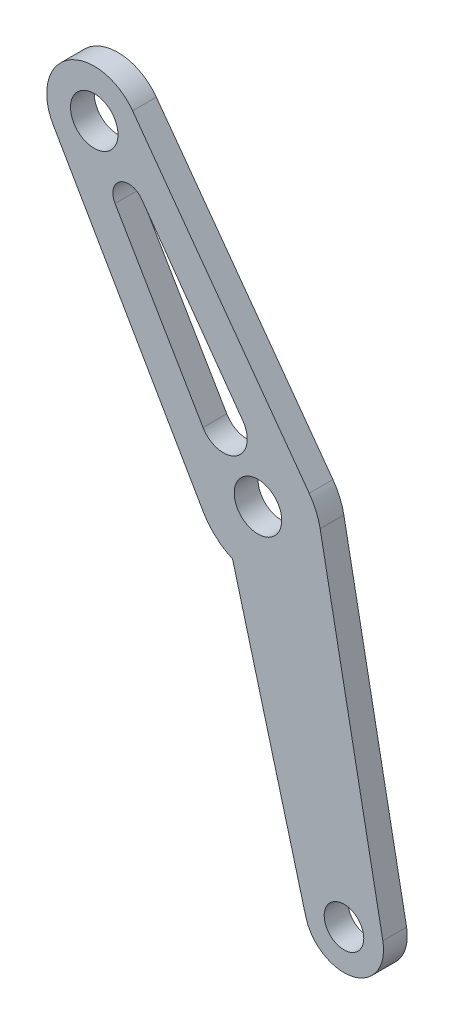
from build123d import *

# Parameters (mm, degrees)
SKETCH_2_R      = 2.5
SKETCH_2_R_2    = 3
EXTRUDE_1_DEPTH = 3


with BuildPart() as part:
    # 草图2 → 凸台-拉伸1 (new body)
    with BuildSketch(Plane.XY):
        with BuildLine():
            Line((-37.947439952, 28.393304212), (-18.983503384, -4.475664586))
            ThreePointArc((-18.983503384, -4.475664586), (-17.391534203, -6.436907823), (-15.267421048, -7.804015799))
            Line((-15.267421048, -7.804015799), (-6.013345572, -42.340695651))
            ThreePointArc((-6.013345572, -42.340695651), (-0.063044856, -45.919391741), (3.726011827, -40.100784195))
            Line((3.726011827, -40.100784195), (-4.198551107, 1.035590248))
            ThreePointArc((-4.198551107, 1.035590248), (-4.715435995, 2.707212985), (-5.583372683, 4.226482041))
            Line((-5.583372683, 4.226482041), (-27.897341927, 34.919914183))
            ThreePointArc((-27.897341927, 34.919914183), (-36.018233875, 36.423789268), (-37.947439952, 28.393304212))
        make_face()
        with Locations((-1.18371644, -41.046600426)):
            Circle(SKETCH_2_R, mode=Mode.SUBTRACT)
        with Locations((-12.054116335, -0.477715722)):
            Circle(SKETCH_2_R_2, mode=Mode.SUBTRACT)
        with Locations((-32.750399665, 31.39176586)):
            Circle(SKETCH_2_R_2, mode=Mode.SUBTRACT)
        with BuildLine():
            Line((-30.118407474, 23.670491895), (-18.998908748, 4.713784689))
            ThreePointArc((-18.998908748, 4.713784689), (-14.77731151, 3.715637118), (-13.9720864, 7.978241292))
            Line((-13.9720864, 7.978241292), (-26.767192575, 25.846796296))
            ThreePointArc((-26.767192575, 25.846796296), (-29.482565455, 26.359742452), (-30.118407474, 23.670491895))
        make_face(mode=Mode.SUBTRACT)
    extrude(amount=EXTRUDE_1_DEPTH)


solid = part.part
